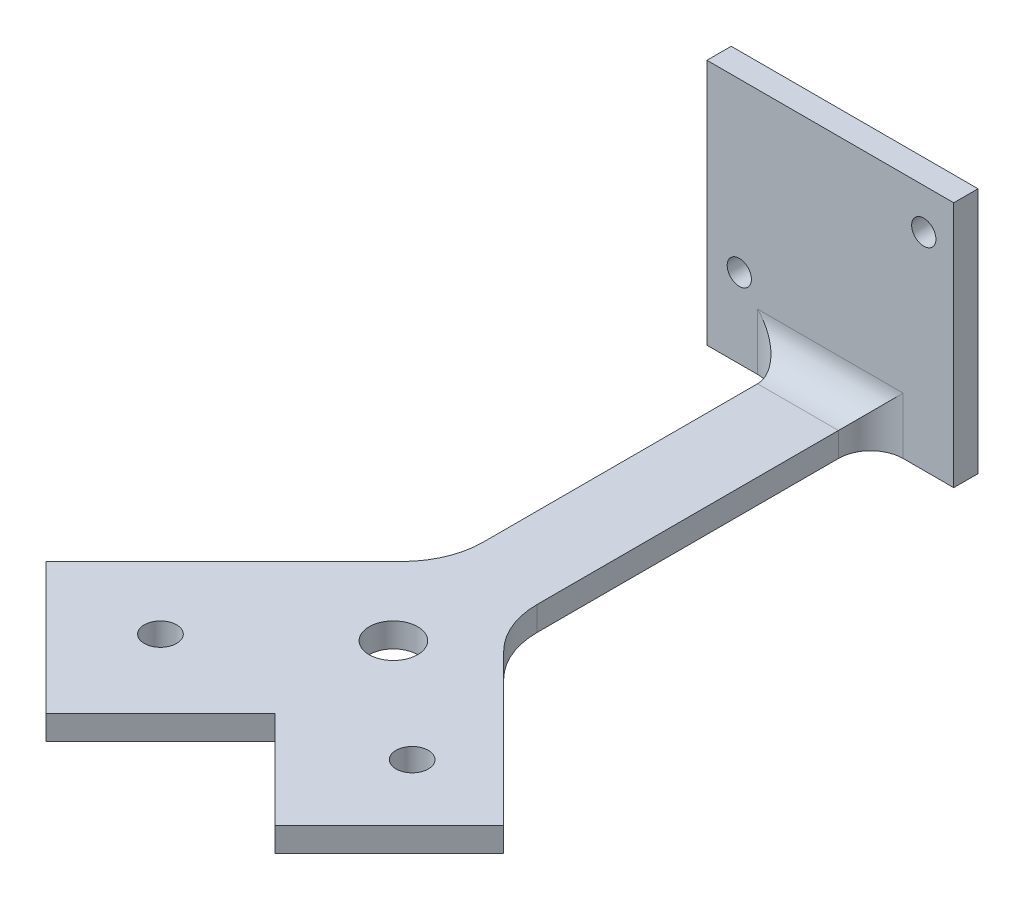
from build123d import *

# Parameters (mm, degrees)
SKETCH1_W             = 30.5
SKETCH1_H             = 30.5
BOSS_EXTRUDE1_DEPTH   = 3
SKETCH2_W             = 10
SKETCH2_H             = 60
BOSS_EXTRUDE2_DEPTH   = 3
BOSS_EXTRUDE3_DEPTH   = 3
F_3_0MM_DOWEL_HOLE1_D = 3
FILLET1_R             = 4
FILLET2_R             = 10
SKETCH6_R             = 3
CUT_EXTRUDE1_DEPTH    = 3
F_4_0MM_DOWEL_HOLE1_D = 4
F_4_0MM_DOWEL_HOLE2_D = 4


with BuildPart() as part:
    # Sketch1 → Boss-Extrude1 (new body)
    with BuildSketch(Plane.XY):
        with Locations((15.25, 15.25)):
            Rectangle(SKETCH1_W, SKETCH1_H)
    extrude(amount=BOSS_EXTRUDE1_DEPTH)

    # Sketch2 → Boss-Extrude2 (add)
    with BuildSketch(Plane.XZ):
        with Locations((15.25, 33)):
            Rectangle(SKETCH2_W, SKETCH2_H)
    extrude(amount=-BOSS_EXTRUDE2_DEPTH)

    # Sketch3 → Boss-Extrude3 (add)
    with BuildSketch(Plane.XZ):
        Polygon((22.565242881, 50.684757119), (13.584450202, 41.70396444), (-14.699821045, 69.988235687), (1.563634922, 86.251691655), (15.705770546, 72.109556031), (27.726585826, 84.130371311), (41.86872145, 69.988235687), align=None)
    extrude(amount=-BOSS_EXTRUDE3_DEPTH)

    # Ø3.0mm Dowel Hole1 (through all)
    with Locations(Plane.XY.offset(3)):
        with Locations((4, 9.8), (26.8, 25.5)):
            Hole(F_3_0MM_DOWEL_HOLE1_D / 2)

    # Fillet1
    fillet1_edges = [part.edges().sort_by_distance(p)[0] for p in [
        (10.25, 1.5, 3),
        (15.25, 3, 3),
        (20.25, 1.5, 3),
    ]]
    fillet(fillet1_edges, radius=FILLET1_R)

    # Fillet2
    fillet2_edges = [part.edges().sort_by_distance(p)[0] for p in [
        (20.25, 1.5, 48.369514237),
        (10.25, 1.5, 45.038414642),
    ]]
    fillet(fillet2_edges, radius=FILLET2_R)

    # Sketch6 → Cut-Extrude1 (cut)
    with BuildSketch(Plane(origin=(0, 3, 0), x_dir=(1, 0, 0), z_dir=(0, 1, 0))):
        with Locations(Location((15.25, -57, 0), (0, 0, 270))):
            Circle(SKETCH6_R)
    extrude(amount=-CUT_EXTRUDE1_DEPTH, mode=Mode.SUBTRACT)

    # Ø4.0mm Dowel Hole1 (through all)
    with Locations(Plane(origin=(0, 3, 0), x_dir=(1, 0, 0), z_dir=(0, 1, 0))):
        with Locations((0.14942136, -70.695342468)):
            Hole(F_4_0MM_DOWEL_HOLE1_D / 2)

    # Ø4.0mm Dowel Hole2 (through all)
    with Locations(Plane(origin=(0, 3, 0), x_dir=(1, 0, 0), z_dir=(0, 1, 0))):
        with Locations((29.140799389, -68.574022125)):
            Hole(F_4_0MM_DOWEL_HOLE2_D / 2)


solid = part.part
